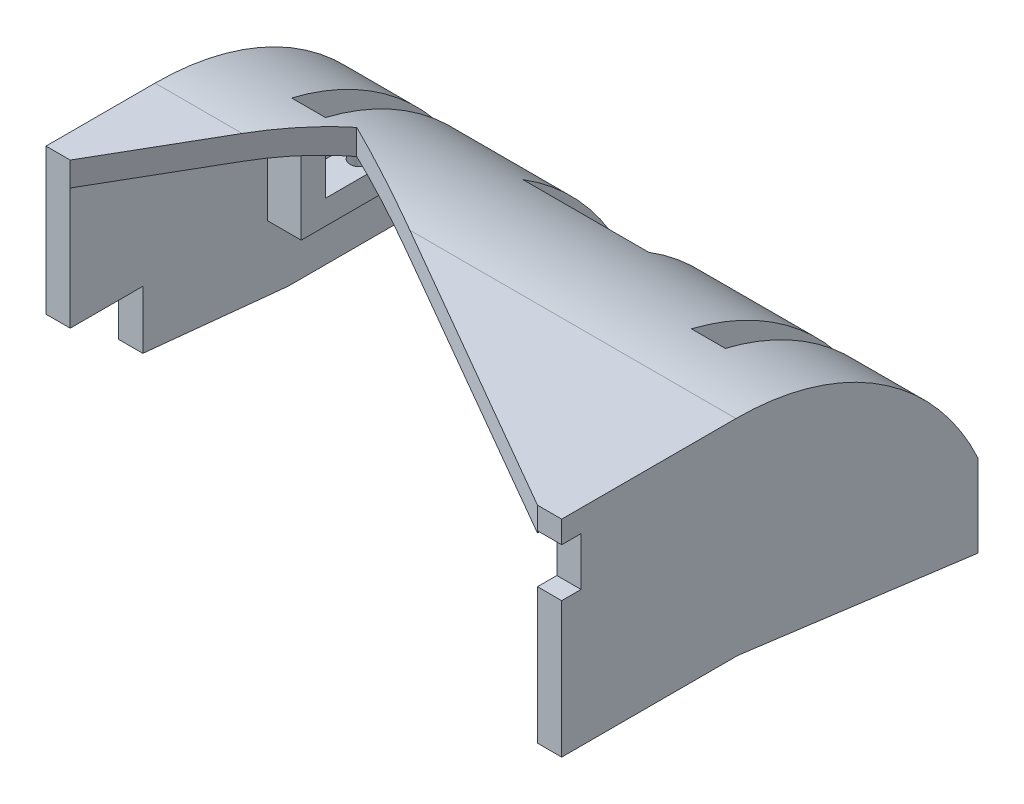
from build123d import *

# Parameters (mm, degrees)
BOSS_EXTRUDE1_DEPTH = 110
CUT_EXTRUDE1_DEPTH  = 110
SKETCH3_W           = 110
SKETCH3_H           = 22.912878475
CUT_EXTRUDE2_DEPTH  = 110
SKETCH4_W           = 10.2
SKETCH4_H           = 5.559027913
SKETCH4_W_2         = 24.8
SKETCH4_H_2         = 2.559027913
BOSS_EXTRUDE2_DEPTH = 13
SKETCH5_W           = 7
SKETCH5_H           = 5
BOSS_EXTRUDE3_DEPTH = 16
SKETCH6_W           = 10.2
SKETCH6_H           = 5.559027913
SKETCH6_W_2         = 24.8
SKETCH6_H_2         = 2.559027913
BOSS_EXTRUDE4_DEPTH = 4
CUT_EXTRUDE3_DEPTH  = 64
SKETCH8_W           = 7
SKETCH8_H           = 5
BOSS_EXTRUDE5_DEPTH = 15
SKETCH9_R           = 2
CUT_EXTRUDE4_DEPTH  = 10
BOSS_EXTRUDE6_START = 5
BOSS_EXTRUDE6_DEPTH = 5
BOSS_EXTRUDE7_DEPTH = 5


with BuildPart() as part:
    # Sketch1 → Boss-Extrude1 (new body)
    with BuildSketch(Plane(origin=(0, 0, 0), x_dir=(0, 0, -1), z_dir=(1, 0, 0))):
        with BuildLine():
            Line((0, 55), (-36, 55))
            Line((-36, 55), (-36, 50))
            Line((-36, 50), (0, 50))
            ThreePointArc((0, 50), (35.355339059, 35.355339059), (50, 0))
            Line((50, 0), (50, -1))
            Line((50, -1), (55, -1))
            Line((55, -1), (55, 0))
            ThreePointArc((55, 0), (38.890872965, 38.890872965), (0, 55))
        make_face()
    extrude(amount=BOSS_EXTRUDE1_DEPTH)

    # Sketch2 → Cut-Extrude1 (cut)
    with BuildSketch(Plane(origin=(0, 55, 0), x_dir=(1, 0, 0), z_dir=(0, 1, 0))):
        Polygon((99.8, 13), (92.8, 13), (92.8, 47), (68, 47), (68, 29), (42, 29), (42, 47), (17.2, 47), (17.2, 13), (10.2, 13), (10.2, 50), (-27.805612869, 50), (-27.805612869, 77.075699265), (114.223867828, 77.075699265), (114.223867828, 50), (99.8, 50), align=None)
    extrude(amount=-CUT_EXTRUDE1_DEPTH, mode=Mode.SUBTRACT)

    # Sketch3 → Cut-Extrude2 (cut)
    with BuildSketch(Plane(origin=(0, 0, -50), x_dir=(-1, 0, 0), z_dir=(0, 0, -1))):
        with Locations((-55, 11.456439238)):
            Rectangle(SKETCH3_W, SKETCH3_H)
    extrude(amount=-CUT_EXTRUDE2_DEPTH, mode=Mode.SUBTRACT)

    # Sketch4 → Boss-Extrude2 (add)
    with BuildSketch(Plane.XZ.offset(-22.912878475)):
        with Locations((104.9, -47.220486044)):
            Rectangle(SKETCH4_W, SKETCH4_H)
        with Locations((80.4, -45.720486044)):
            Rectangle(SKETCH4_W_2, SKETCH4_H_2)
        with Locations((29.6, -45.720486044)):
            Rectangle(SKETCH4_W_2, SKETCH4_H_2)
        with Locations((5.1, -47.220486044)):
            Rectangle(SKETCH4_W, SKETCH4_H)
    extrude(amount=BOSS_EXTRUDE2_DEPTH)

    # Sketch5 → Boss-Extrude3 (add)
    with BuildSketch(Plane.XZ.offset(-50)):
        with Locations((13.7, -10.5)):
            Rectangle(SKETCH5_W, SKETCH5_H)
        with Locations((96.3, -10.5)):
            Rectangle(SKETCH5_W, SKETCH5_H)
    extrude(amount=BOSS_EXTRUDE3_DEPTH)

    # Sketch6 → Boss-Extrude4 (add)
    with BuildSketch(Plane.XZ.offset(-9.912878475)):
        with Locations((104.9, -47.220486044)):
            Rectangle(SKETCH6_W, SKETCH6_H)
        with Locations((80.4, -45.720486044)):
            Rectangle(SKETCH6_W_2, SKETCH6_H_2)
    extrude(amount=BOSS_EXTRUDE4_DEPTH)

    # Sketch7 → Cut-Extrude3 (cut)
    with BuildSketch(Plane(origin=(0, 55, 0), x_dir=(1, 0, 0), z_dir=(0, 1, 0))):
        Polygon((110, -36), (21.665408814, 15), (0, -22.525588833), (0, -36), align=None)
    extrude(amount=-CUT_EXTRUDE3_DEPTH, mode=Mode.SUBTRACT)

    # Sketch8 → Boss-Extrude5 (add)
    with BuildSketch(Plane(origin=(0, 0, -13), x_dir=(-1, 0, 0), z_dir=(0, 0, -1))):
        with Locations((-13.7, 36.5)):
            Rectangle(SKETCH8_W, SKETCH8_H)
        with Locations((-96.3, 36.5)):
            Rectangle(SKETCH8_W, SKETCH8_H)
    extrude(amount=BOSS_EXTRUDE5_DEPTH)

    # Sketch9 → Cut-Extrude4 (cut)
    with BuildSketch(Plane(origin=(0, 39, 0), x_dir=(1, 0, 0), z_dir=(0, 1, 0))):
        with Locations(Location((13.7, 23.6, 0), (0, 0, 270))):
            Circle(SKETCH9_R)
        with Locations(Location((96.3, 23.6, 0), (0, 0, 270))):
            Circle(SKETCH9_R)
    extrude(amount=-CUT_EXTRUDE4_DEPTH, mode=Mode.SUBTRACT)

    # Sketch10 → Boss-Extrude6 (add)
    with BuildSketch(Plane.ZY.offset(BOSS_EXTRUDE6_START)):
        with BuildLine():
            Line((-50, 9.912878475), (-22.474411167, 9.912878475))
            Line((-22.474411167, 9.912878475), (7.525588833, 12.912878475))
            Line((7.525588833, 12.912878475), (7.525588833, 24.912878475))
            Line((7.525588833, 24.912878475), (22.525588833, 24.912878475))
            Line((22.525588833, 24.912878475), (22.525588833, 55))
            Line((22.525588833, 55), (0, 55))
            ThreePointArc((0, 55), (-29.705148408, 46.28827236), (-50, 22.912878475))
            Line((-50, 22.912878475), (-50, 9.912878475))
        make_face()
    extrude(amount=-BOSS_EXTRUDE6_DEPTH)

    # Sketch11 → Boss-Extrude7 (add)
    with BuildSketch(Plane(origin=(110, 0, 0), x_dir=(0, 0, -1), z_dir=(1, 0, 0))):
        with BuildLine():
            Line((-36, 50.412878475), (-32, 50.412878475))
            Line((-32, 50.412878475), (-32, 40.412878475))
            Line((-32, 40.412878475), (-36, 40.412878475))
            Line((-36, 40.412878475), (-36, 12.412878475))
            Line((-36, 12.412878475), (0.424300308, 12.412878475))
            Line((0.424300308, 12.412878475), (50, 5.912878475))
            Line((50, 5.912878475), (50, 22.912878475))
            ThreePointArc((50, 22.912878475), (29.705148408, 46.28827236), (0, 55))
            Line((0, 55), (-36, 55))
            Line((-36, 55), (-36, 50.412878475))
        make_face()
    extrude(amount=BOSS_EXTRUDE7_DEPTH)


solid = part.part
